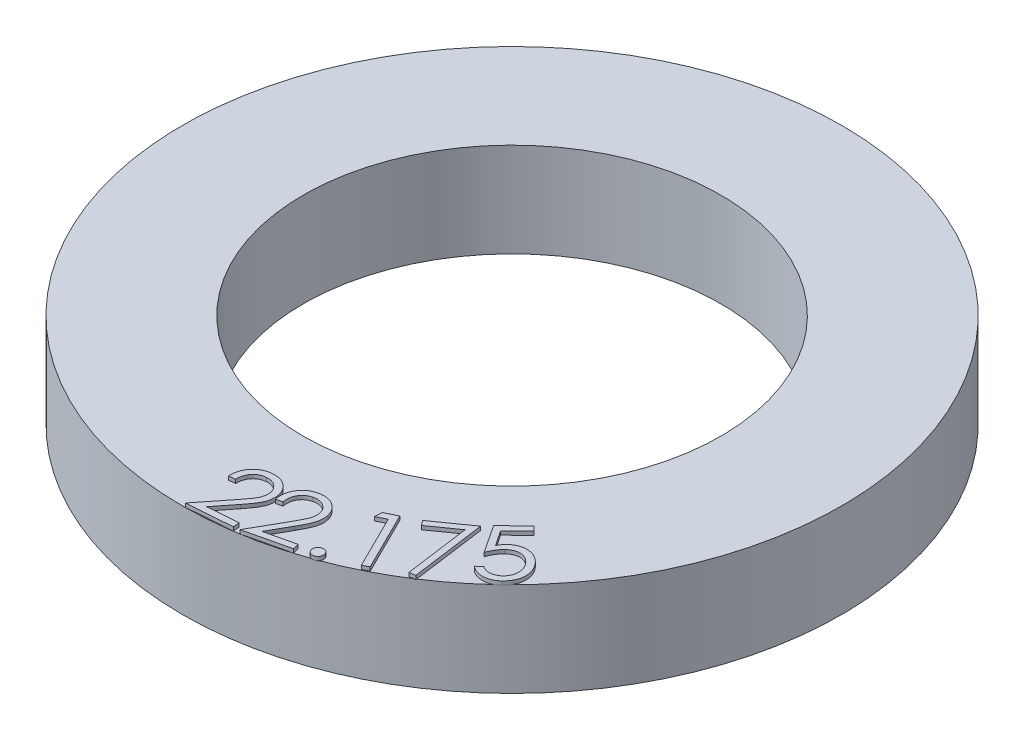
from build123d import *

# Parameters (mm, degrees)
SKETCH1_R           = 17.5
SKETCH1_R_2         = 11.0875
BOSS_EXTRUDE1_DEPTH = 5
BOSS_EXTRUDE7_DEPTH = 0.2


with BuildPart() as part:
    # Sketch1 → Boss-Extrude1 (new body)
    with BuildSketch(Plane(origin=(0, 0, 0), x_dir=(1, 0, 0), z_dir=(0, 1, 0))):
        Circle(SKETCH1_R)
        Circle(SKETCH1_R_2, mode=Mode.SUBTRACT)
    extrude(amount=BOSS_EXTRUDE1_DEPTH)

    # Sketch7 → Boss-Extrude7 (add)
    with BuildSketch(Plane(origin=(0, 5, 0), x_dir=(1, 0, 0), z_dir=(0, 1, 0))):
        with BuildLine():
            Line((0.377203526, -15.06640625), (0.043469551, -15.092347756))
            add(Edge.make_bspline(
                [(0.043469551, -15.092347756), (0.042203297, -15.050032699), (0.039723419, -14.96716131), (0.049638285, -14.844981972), (0.067688405, -14.727624407), (0.098455755, -14.61556583), (0.138504263, -14.508522308), (0.188279293, -14.405930448), (0.249943807, -14.309195828), (0.320224245, -14.217586795), (0.399116148, -14.133937543), (0.484222111, -14.059456033), (0.574336923, -13.993992114), (0.671078969, -13.940092371), (0.773224869, -13.895612995), (0.881084602, -13.861423192), (0.994390789, -13.836174987), (1.072362547, -13.828578994), (1.111979167, -13.824719551)],
                knots=[0, 0, 0, 0, 1.099165856, 2.152647473, 3.179901334, 4.180092559, 5.165857059, 6.14623908, 7.136854445, 8.141313093, 9.142222958, 10.119044223, 11.076246807, 12.030555843, 12.990566437, 13.966122304, 14.966608418, 16, 16, 16, 16], degree=3))
            add(Edge.make_bspline(
                [(1.111979167, -13.824719551), (1.151232363, -13.822614291), (1.227892409, -13.818502795), (1.341072803, -13.824300473), (1.449209712, -13.840047194), (1.552456645, -13.867170925), (1.650809554, -13.903432336), (1.744251767, -13.950064736), (1.832189716, -14.007297288), (1.914237577, -14.07371881), (1.989801801, -14.146775331), (2.056191283, -14.225750107), (2.115236363, -14.307662186), (2.163673815, -14.394967734), (2.203994369, -14.485852699), (2.23381166, -14.581483532), (2.256306856, -14.680631266), (2.263224051, -14.74868976), (2.266726763, -14.783153045)],
                knots=[0, 0, 0, 0, 1.125255338, 2.197582177, 3.23984224, 4.249678898, 5.249348258, 6.237204937, 7.234226399, 8.248247252, 9.256507582, 10.239567543, 11.199778339, 12.143800945, 13.093950023, 14.042329097, 15.008679649, 16, 16, 16, 16], degree=3))
            add(Edge.make_bspline(
                [(2.266726763, -14.783153045), (2.268653871, -14.83201524), (2.272472697, -14.928842275), (2.256591946, -15.073272294), (2.221554197, -15.213909987), (2.177756368, -15.329043673), (2.13210079, -15.422970742), (2.088829613, -15.499650514), (2.039151976, -15.583479859), (1.980752569, -15.67318269), (1.913642882, -15.76882397), (1.840613729, -15.872212721), (1.757921696, -15.980725817), (1.700055339, -16.055042687), (1.670072115, -16.093549679)],
                knots=[0, 0, 0, 0, 1.190284496, 2.358709392, 3.525773572, 4.713480732, 5.352743619, 6.06901355, 6.858115264, 7.726847504, 8.676217017, 9.704931629, 10.810819393, 12, 12, 12, 12], degree=3))
            Line((1.670072115, -16.093549679), (0.875701122, -17.094751603))
            Line((0.875701122, -17.094751603), (2.482672276, -16.971354167))
            Line((2.482672276, -16.971354167), (2.508613782, -17.307191506))
            Line((2.508613782, -17.307191506), (0.14443109, -17.488782051))
            Line((0.14443109, -17.488782051), (1.363681891, -15.949819712))
            add(Edge.make_bspline(
                [(1.363681891, -15.949819712), (1.393527022, -15.912554926), (1.450782044, -15.841066007), (1.530584566, -15.73612355), (1.602999147, -15.639675593), (1.666852925, -15.550639363), (1.722438282, -15.469396851), (1.76961629, -15.395481899), (1.809021619, -15.329602995), (1.849329165, -15.251857602), (1.888211722, -15.159145837), (1.917541309, -15.046099013), (1.933704742, -14.93175562), (1.93042781, -14.855174346), (1.928786058, -14.816806891)],
                knots=[0, 0, 0, 0, 1.323859622, 2.539697786, 3.655679983, 4.668207506, 5.577749991, 6.384956845, 7.099630202, 7.705429782, 8.812646299, 9.878423536, 10.93708365, 12, 12, 12, 12], degree=3))
            add(Edge.make_bspline(
                [(1.928786058, -14.816806891), (1.92620974, -14.792668697), (1.921140936, -14.745177743), (1.905685163, -14.675960851), (1.882668381, -14.610204079), (1.854314913, -14.54686504), (1.818130268, -14.487171166), (1.775716227, -14.430480301), (1.726271651, -14.377301953), (1.671340099, -14.327125852), (1.611934069, -14.281949704), (1.548780398, -14.24375581), (1.483443961, -14.212316408), (1.415907726, -14.186368957), (1.345139571, -14.169292508), (1.271999298, -14.157876025), (1.196114655, -14.153502913), (1.144924611, -14.156323447), (1.118990385, -14.157752404)],
                knots=[0, 0, 0, 0, 1.002985613, 1.973335034, 2.923515741, 3.878986154, 4.836651989, 5.802759845, 6.800988188, 7.833639541, 8.87511098, 9.880838076, 10.878972912, 11.86950441, 12.865345595, 13.881918786, 14.926924211, 16, 16, 16, 16], degree=3))
            add(Edge.make_bspline(
                [(1.118990385, -14.157752404), (1.091811261, -14.160540619), (1.038491161, -14.166010548), (0.960749235, -14.182373159), (0.886899306, -14.205342141), (0.817246391, -14.235736869), (0.751710741, -14.272344942), (0.690146343, -14.315288584), (0.633132276, -14.365692478), (0.580060436, -14.422065975), (0.532383632, -14.484564259), (0.490634628, -14.552362028), (0.455698611, -14.625546395), (0.426899376, -14.703718722), (0.404472482, -14.787020099), (0.388336351, -14.875402791), (0.379467781, -14.969236984), (0.377971809, -15.033435801), (0.377203526, -15.06640625)],
                knots=[0, 0, 0, 0, 1.003856858, 1.969369873, 2.914991585, 3.842326504, 4.757764574, 5.67065914, 6.596081697, 7.550367434, 8.512664105, 9.480773, 10.472199548, 11.488843046, 12.539268398, 13.639696742, 14.787824085, 16, 16, 16, 16], degree=3))
        make_face()
        with BuildLine():
            Line((2.680077799, -14.84254585), (2.355458408, -14.918267004))
            add(Edge.make_bspline(
                [(2.355458408, -14.918267004), (2.347994142, -14.876767046), (2.333387531, -14.795556953), (2.323472579, -14.673990721), (2.324976016, -14.555728299), (2.336513827, -14.440605451), (2.359783356, -14.328975701), (2.394590343, -14.221092867), (2.439601661, -14.116379831), (2.494569659, -14.015576781), (2.559832485, -13.921863348), (2.631188548, -13.834656401), (2.710921768, -13.757361702), (2.797573287, -13.688946733), (2.891342116, -13.629703088), (2.992353062, -13.580084855), (3.099856127, -13.537971321), (3.175300136, -13.518303724), (3.213631485, -13.508311075)],
                knots=[0, 0, 0, 0, 1.100238416, 2.153025381, 3.178012026, 4.183884262, 5.168591255, 6.148695239, 7.138002634, 8.140019377, 9.140121407, 10.114951831, 11.077023251, 12.032670763, 12.99234068, 13.966349905, 14.966749606, 16, 16, 16, 16], degree=3))
            add(Edge.make_bspline(
                [(3.213631485, -13.508311075), (3.251843088, -13.50036415), (3.32664053, -13.484808413), (3.438897548, -13.473770246), (3.547813259, -13.472847982), (3.653615731, -13.482442125), (3.755983303, -13.503477882), (3.854414489, -13.536291351), (3.950096274, -13.578421826), (4.040814221, -13.631584861), (4.126003653, -13.692404589), (4.204208412, -13.758970295), (4.274030899, -13.831494589), (4.335160407, -13.90960072), (4.388361962, -13.993145467), (4.432982751, -14.082231672), (4.470178835, -14.176708828), (4.487307474, -14.242643219), (4.495983248, -14.27603944)],
                knots=[0, 0, 0, 0, 1.121990491, 2.196244399, 3.238232453, 4.250969426, 5.246356061, 6.236987075, 7.230101134, 8.248200839, 9.255501669, 10.237657177, 11.19803806, 12.146105858, 13.086011545, 14.042029985, 15.008274769, 16, 16, 16, 16], degree=3))
            add(Edge.make_bspline(
                [(4.495983248, -14.27603944), (4.505415824, -14.323774993), (4.524110077, -14.41838123), (4.529985585, -14.56283772), (4.516844757, -14.706380405), (4.49162199, -14.826395359), (4.460506924, -14.925374116), (4.431085731, -15.007919873), (4.393488718, -15.097141834), (4.349829317, -15.194418504), (4.299347185, -15.299042154), (4.242538162, -15.411720311), (4.177915647, -15.531101044), (4.131979942, -15.612908193), (4.108262895, -15.655146011)],
                knots=[0, 0, 0, 0, 1.190223456, 2.358882579, 3.52524119, 4.712819824, 5.35365978, 6.065105631, 6.857984567, 7.723828008, 8.67607557, 9.702436758, 10.813745988, 12, 12, 12, 12], degree=3))
            Line((4.108262895, -15.655146011), (3.479356645, -16.761516203))
            Line((3.479356645, -16.761516203), (5.041456004, -16.394829504))
            Line((5.041456004, -16.394829504), (5.11787828, -16.721552261))
            Line((5.11787828, -16.721552261), (2.819601036, -17.260714921))
            Line((2.819601036, -17.260714921), (3.785045748, -15.56119569))
            add(Edge.make_bspline(
                [(3.785045748, -15.56119569), (3.808529371, -15.519892567), (3.8536226, -15.440582352), (3.91665988, -15.325551236), (3.973290102, -15.219474376), (4.021957514, -15.121779814), (4.064311127, -15.032979861), (4.100364837, -14.953571722), (4.128654637, -14.882434307), (4.156784414, -14.800101176), (4.179688984, -14.702577351), (4.192972915, -14.587024863), (4.189968714, -14.471889792), (4.175230987, -14.396958355), (4.167858248, -14.359472934)],
                knots=[0, 0, 0, 0, 1.322508168, 2.539478858, 3.65113322, 4.669382137, 5.577246142, 6.389686428, 7.096378664, 7.707362647, 8.810322298, 9.877140803, 10.938012216, 12, 12, 12, 12], degree=3))
            add(Edge.make_bspline(
                [(4.167858248, -14.359472934), (4.161829404, -14.336171476), (4.149935411, -14.290201239), (4.123387221, -14.224893717), (4.091995869, -14.16328915), (4.053584185, -14.106135055), (4.009399893, -14.052600205), (3.95860095, -14.003544562), (3.901957352, -13.958350343), (3.840235373, -13.917568468), (3.775029978, -13.881814057), (3.707248163, -13.853637752), (3.637912338, -13.832678602), (3.56741324, -13.817301491), (3.494890393, -13.811664684), (3.421495235, -13.811468351), (3.346244991, -13.818247864), (3.296509601, -13.82889709), (3.271123472, -13.834332709)],
                knots=[0, 0, 0, 0, 0.998805992, 1.97049261, 2.921394182, 3.866479787, 4.824835265, 5.799717433, 6.794315519, 7.830951375, 8.869177059, 9.878822869, 10.873799922, 11.875291578, 12.869368348, 13.888722291, 14.922353531, 16, 16, 16, 16], degree=3))
            add(Edge.make_bspline(
                [(3.271123472, -13.834332709), (3.244792519, -13.841064204), (3.193002937, -13.854304184), (3.119061623, -13.882705923), (3.050115946, -13.91714881), (2.986034959, -13.957311139), (2.926579811, -14.002814596), (2.87305675, -14.05555418), (2.823928987, -14.113545846), (2.780414933, -14.177443519), (2.743380272, -14.246402199), (2.712244756, -14.319205359), (2.689061885, -14.396615139), (2.673136557, -14.477873433), (2.664009273, -14.563501926), (2.662180891, -14.653056839), (2.666949138, -14.746824786), (2.675629023, -14.810109822), (2.680077799, -14.84254585)],
                knots=[0, 0, 0, 0, 1.001857296, 1.97052376, 2.915105733, 3.840812044, 4.756468097, 5.670946457, 6.606992161, 7.556283339, 8.516782409, 9.490308786, 10.47212129, 11.491627338, 12.540773751, 13.644567144, 14.792749573, 16, 16, 16, 16], degree=3))
        make_face()
        with BuildLine():
            add(Edge.make_bspline(
                [(5.812610444, -15.938128556), (5.831374417, -15.932374898), (5.868100028, -15.921113607), (5.925587729, -15.918820778), (5.982023209, -15.927326543), (6.036365652, -15.947186897), (6.086750753, -15.976062519), (6.129683552, -16.014781695), (6.164195697, -16.061839206), (6.179302393, -16.097844445), (6.187009483, -16.116213491)],
                knots=[0, 0, 0, 0, 1.018533362, 1.993514881, 2.966138152, 3.9748784, 4.989476654, 5.972026843, 6.965374611, 8, 8, 8, 8], degree=3))
            add(Edge.make_bspline(
                [(6.187009483, -16.116213491), (6.192680674, -16.134982532), (6.203852009, -16.171954526), (6.207259114, -16.229869607), (6.198423544, -16.286997519), (6.178873974, -16.341926891), (6.149719297, -16.392227049), (6.111823907, -16.435344643), (6.065578658, -16.469979456), (6.029886494, -16.484584723), (6.011729034, -16.492014773)],
                knots=[0, 0, 0, 0, 1.018247088, 2.005783202, 2.990165439, 4.010083513, 5.024396598, 5.998572224, 6.981825626, 8, 8, 8, 8], degree=3))
            add(Edge.make_bspline(
                [(6.011729034, -16.492014773), (5.992964701, -16.497770106), (5.956238387, -16.509034678), (5.898755786, -16.511303732), (5.842003107, -16.502843983), (5.787364663, -16.482393394), (5.737095106, -16.452595757), (5.694096527, -16.414271405), (5.660232144, -16.367416245), (5.645083379, -16.332037335), (5.637329996, -16.313929838)],
                knots=[0, 0, 0, 0, 1.019327242, 1.995068695, 2.968450063, 3.99358383, 5.015165017, 5.99848104, 6.975590248, 8, 8, 8, 8], degree=3))
            add(Edge.make_bspline(
                [(5.637329996, -16.313929838), (5.63125142, -16.294941947), (5.619366426, -16.257816312), (5.617673921, -16.1996281), (5.624612676, -16.142442807), (5.645777227, -16.087974496), (5.675371175, -16.038150206), (5.712952105, -15.994657098), (5.759716127, -15.961248414), (5.794765915, -15.945928316), (5.812610444, -15.938128556)],
                knots=[0, 0, 0, 0, 1.033330105, 2.02039479, 3.003248301, 4.016090021, 5.036799157, 6.01117572, 6.98745084, 8, 8, 8, 8], degree=3))
        make_face()
        Polygon((5.818273577, -12.696277718), (6.43245627, -12.391289737), (7.984038802, -15.51759182), (7.673441847, -15.671838615), (6.274002744, -12.851926756), (5.783217488, -13.095216019), align=None)
        Polygon((7.247667499, -11.988691345), (9.046746025, -10.715454165), (9.587310929, -14.697124838), (9.269001634, -14.741996633), (8.796445544, -11.294580768), (7.436970384, -12.25651987), align=None)
        with BuildLine():
            Line((10.452754524, -9.291042604), (10.68552696, -9.530826258))
            Line((10.68552696, -9.530826258), (9.789493306, -10.399516162))
            Line((9.789493306, -10.399516162), (10.327954844, -11.205105104))
            add(Edge.make_bspline(
                [(10.327954844, -11.205105104), (10.347405355, -11.172122652), (10.385204959, -11.108025431), (10.446885728, -11.0193262), (10.509702256, -10.939697419), (10.555405561, -10.893202352), (10.577554203, -10.870670008)],
                knots=[0, 0, 0, 0, 1.0972362, 2.132339663, 3.094898282, 4, 4, 4, 4], degree=3))
            add(Edge.make_bspline(
                [(10.577554203, -10.870670008), (10.606317416, -10.844200281), (10.662747921, -10.792269364), (10.753702799, -10.724629144), (10.848024177, -10.668009567), (10.945991502, -10.62309149), (11.04674006, -10.588531661), (11.150525188, -10.564262159), (11.257758966, -10.552017687), (11.36719103, -10.549746582), (11.476645925, -10.558902183), (11.583969895, -10.578635191), (11.688412673, -10.608797506), (11.789577002, -10.650442128), (11.88756755, -10.702847316), (11.982623387, -10.765422339), (12.074164549, -10.839462139), (12.130996143, -10.895414044), (12.159986094, -10.923955265)],
                knots=[0, 0, 0, 0, 1.056660519, 2.073060671, 3.059518756, 4.02677442, 4.98224816, 5.935943106, 6.903425925, 7.895980916, 8.891750929, 9.868685659, 10.842855965, 11.826495158, 12.821843791, 13.84390824, 14.900171671, 16, 16, 16, 16], degree=3))
            add(Edge.make_bspline(
                [(12.159986094, -10.923955265), (12.179371474, -10.944790443), (12.217879566, -10.986178488), (12.27122311, -11.051190736), (12.319127373, -11.119122899), (12.362370005, -11.188926824), (12.401443021, -11.260839418), (12.434751195, -11.335040663), (12.463945876, -11.411244998), (12.48736708, -11.489374708), (12.506429447, -11.568206729), (12.519773102, -11.646915148), (12.527677962, -11.725163122), (12.529442244, -11.802697072), (12.527212836, -11.879846664), (12.517429582, -11.956344907), (12.503941494, -12.032619884), (12.48378444, -12.107875306), (12.459677752, -12.18213013), (12.429283702, -12.254748742), (12.393111387, -12.325269634), (12.353457012, -12.395471186), (12.306878168, -12.462802716), (12.256204782, -12.529296219), (12.200270131, -12.593980231), (12.159104301, -12.634499511), (12.138251319, -12.655024976)],
                knots=[0, 0, 0, 0, 1.055652629, 2.097001478, 3.117016048, 4.137178009, 5.141932989, 6.150831921, 7.15243954, 8.167281964, 9.17461492, 10.159572065, 11.126698888, 12.089462946, 13.035170943, 13.986940597, 14.947789716, 15.906759268, 16.874624253, 17.842372723, 18.823391324, 19.813866479, 20.831113527, 21.857739712, 22.91481563, 24, 24, 24, 24], degree=3))
            add(Edge.make_bspline(
                [(12.138251319, -12.655024976), (12.112728931, -12.678884978), (12.062572626, -12.725774383), (11.981204616, -12.786743559), (11.897891282, -12.839563216), (11.81168422, -12.883702587), (11.722425767, -12.917787042), (11.630937819, -12.943862727), (11.536875372, -12.961812787), (11.440809295, -12.969665841), (11.344361381, -12.970104026), (11.249100137, -12.960666604), (11.15568141, -12.943230755), (11.064168704, -12.917126414), (10.974739633, -12.88265442), (10.887481161, -12.839323474), (10.801350171, -12.788490568), (10.74732779, -12.747875068), (10.719881928, -12.727240521)],
                knots=[0, 0, 0, 0, 1.074988754, 2.112555675, 3.124661908, 4.109336649, 5.08879237, 6.06132568, 7.03505602, 8.031750268, 9.024697533, 10.000552301, 10.974282641, 11.946815951, 12.926271671, 13.920599676, 14.943568705, 16, 16, 16, 16], degree=3))
            Line((10.719881928, -12.727240521), (10.977894748, -12.477641162))
            add(Edge.make_bspline(
                [(10.977894748, -12.477641162), (11.005569592, -12.495806132), (11.058958533, -12.530849094), (11.142274933, -12.571307457), (11.223303732, -12.601834409), (11.303835464, -12.619418621), (11.384206354, -12.626812892), (11.465592515, -12.622543133), (11.548546659, -12.610395006), (11.631541431, -12.586678649), (11.713315566, -12.555227199), (11.79003461, -12.513203013), (11.863081375, -12.465249111), (11.905744814, -12.425918472), (11.927213658, -12.406126739)],
                knots=[0, 0, 0, 0, 1.146609473, 2.21198236, 3.203991316, 4.141735567, 5.06091789, 5.993607636, 6.960785206, 7.9613937, 8.980047274, 9.991456537, 10.989272553, 12, 12, 12, 12], degree=3))
            add(Edge.make_bspline(
                [(11.927213658, -12.406126739), (11.947116828, -12.386005376), (11.986402209, -12.346289317), (12.035962279, -12.279596876), (12.078460887, -12.209980418), (12.112896717, -12.13660745), (12.140008149, -12.059672512), (12.157877371, -11.97865727), (12.168483663, -11.893913963), (12.170909111, -11.806404543), (12.166734501, -11.718027891), (12.151985482, -11.63131791), (12.130873661, -11.546673074), (12.099180165, -11.465112367), (12.060839275, -11.385488303), (12.013270909, -11.308543182), (11.957268088, -11.234236594), (11.914534234, -11.187928511), (11.892858691, -11.16444004)],
                knots=[0, 0, 0, 0, 0.981100706, 1.936521514, 2.875413226, 3.807837019, 4.744062615, 5.700309258, 6.681141738, 7.70357785, 8.73517306, 9.745864638, 10.751074282, 11.75729772, 12.776576466, 13.814275091, 14.891352574, 16, 16, 16, 16], degree=3))
            add(Edge.make_bspline(
                [(11.892858691, -11.16444004), (11.872137928, -11.144234653), (11.831654893, -11.104758529), (11.766668116, -11.052287247), (11.699295697, -11.008320363), (11.630215196, -10.970995498), (11.558251382, -10.94312445), (11.484493288, -10.922701854), (11.40860198, -10.909885054), (11.331322757, -10.905282683), (11.253452672, -10.907508432), (11.176677684, -10.919966679), (11.101316048, -10.939681012), (11.027016104, -10.966980311), (10.954630799, -11.003921394), (10.883856199, -11.049188603), (10.813827289, -11.101765043), (10.770241753, -11.142289868), (10.7479268, -11.163037797)],
                knots=[0, 0, 0, 0, 1.076879693, 2.103945646, 3.102811146, 4.067885311, 5.020966591, 5.968553643, 6.912420025, 7.879921856, 8.846132302, 9.805780904, 10.767910189, 11.742270505, 12.745972787, 13.786107055, 14.866529529, 16, 16, 16, 16], degree=3))
            add(Edge.make_bspline(
                [(10.7479268, -11.163037797), (10.72944525, -11.18196967), (10.691371943, -11.220970676), (10.637581559, -11.285710865), (10.585073113, -11.357609334), (10.533131962, -11.436086725), (10.482779483, -11.521834294), (10.43353593, -11.614646619), (10.386263425, -11.714834238), (10.356045618, -11.784382409), (10.340575037, -11.819988919)],
                knots=[0, 0, 0, 0, 0.816012069, 1.681042897, 2.593913321, 3.56181962, 4.583248113, 5.660561185, 6.802279776, 8, 8, 8, 8], degree=3))
            Line((10.340575037, -11.819988919), (9.363912376, -10.346230906))
            Line((9.363912376, -10.346230906), (10.452754524, -9.291042604))
        make_face()
    extrude(amount=BOSS_EXTRUDE7_DEPTH)


solid = part.part
